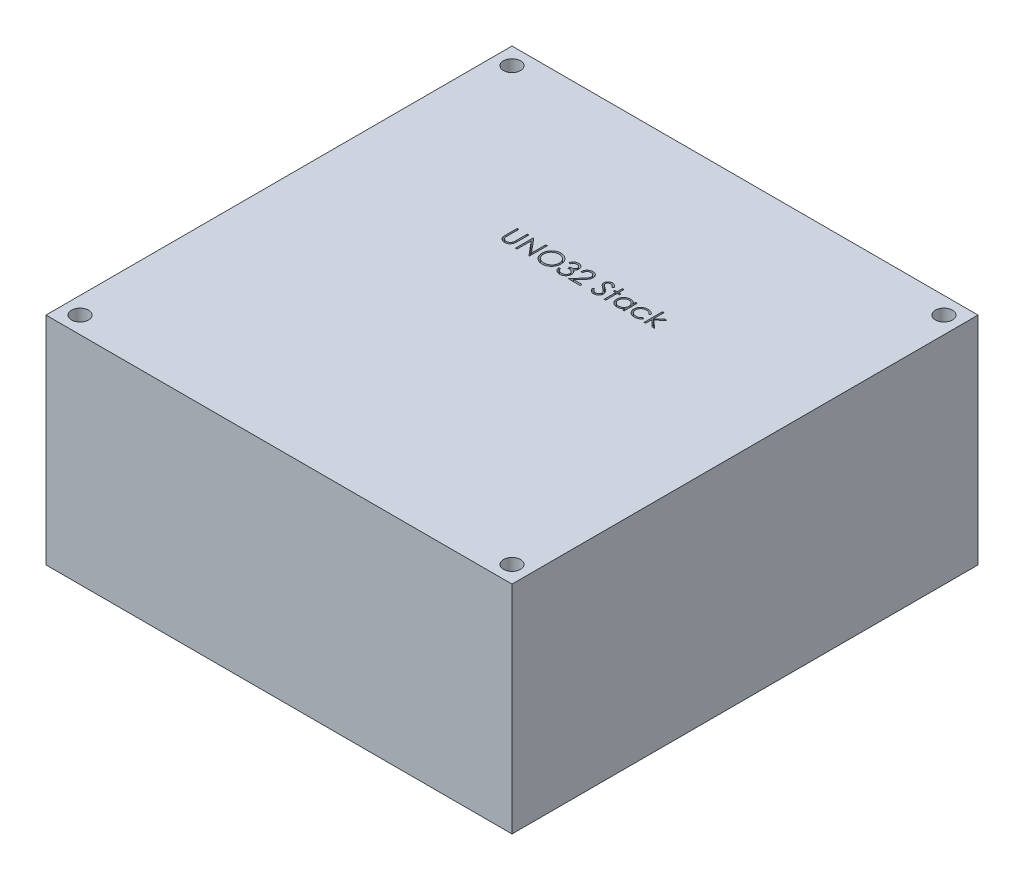
from build123d import *

# Parameters (mm, degrees)
SKETCH1_W           = 82.042
SKETCH1_H           = 82.042
BOSS_EXTRUDE1_DEPTH = 38.1
SKETCH2_R           = 1.5
CUT_EXTRUDE1_DEPTH  = 50.8
CUT_EXTRUDE2_DEPTH  = 1.27


with BuildPart() as part:
    # Sketch1 → Boss-Extrude1 (new body)
    with BuildSketch(Plane(origin=(0, 0, 0), x_dir=(1, 0, 0), z_dir=(0, 1, 0))):
        with Locations((41.021, 41.021)):
            Rectangle(SKETCH1_W, SKETCH1_H)
    extrude(amount=BOSS_EXTRUDE1_DEPTH)

    # Sketch2 → Cut-Extrude1 (cut)
    with BuildSketch(Plane(origin=(0, 38.1, 0), x_dir=(1, 0, 0), z_dir=(0, 1, 0))):
        with Locations(Location((3, 79.042, 0), (0, 0, 270))):
            Circle(SKETCH2_R)
        with Locations(Location((79.042, 79.042, 0), (0, 0, 90))):
            Circle(SKETCH2_R)
        with Locations(Location((79.042, 3, 0), (0, 0, 270))):
            Circle(SKETCH2_R)
        with Locations(Location((3, 3, 0), (0, 0, 90))):
            Circle(SKETCH2_R)
    extrude(amount=-CUT_EXTRUDE1_DEPTH, mode=Mode.SUBTRACT)

    # Sketch4 → Cut-Extrude2 (cut)
    # profile 1 of 10: a face of its own
    with BuildSketch(Plane(origin=(0, 38.1, 0), x_dir=(1, 0, 0), z_dir=(0, 1, 0))):
        with BuildLine():
            Line((28.272940627, 54.696713874), (28.557876525, 54.696713874))
            Line((28.557876525, 54.696713874), (28.557876525, 52.794385148))
            add(Edge.make_bspline(
                [(28.557876525, 52.794385148), (28.557834121, 52.767460481), (28.557753653, 52.716366285), (28.558291148, 52.643642183), (28.559796432, 52.578987881), (28.560745448, 52.522154159), (28.562856672, 52.473401809), (28.564578472, 52.432466706), (28.566792406, 52.39954268), (28.569453162, 52.380328554), (28.570596877, 52.372069443)],
                knots=[0, 0, 0, 0, 1.528628734, 2.90083645, 4.128790002, 5.200304208, 6.127813768, 6.898992206, 7.526736466, 8, 8, 8, 8], degree=3))
            add(Edge.make_bspline(
                [(28.570596877, 52.372069443), (28.575293572, 52.342272737), (28.58442232, 52.284358261), (28.607687248, 52.201891462), (28.640178838, 52.127567925), (28.678680741, 52.059068397), (28.72941961, 51.998299477), (28.790201388, 51.942318192), (28.863841221, 51.893358055), (28.945720485, 51.848589819), (29.033972093, 51.812607923), (29.124152314, 51.785399656), (29.214905588, 51.768818083), (29.275662537, 51.76689808), (29.305833255, 51.765944644)],
                knots=[0, 0, 0, 0, 1.035780045, 2.013197591, 2.933192213, 3.817615948, 4.702609284, 5.640816605, 6.646850145, 7.73207398, 8.84249596, 9.914020372, 10.964143139, 12, 12, 12, 12], degree=3))
            add(Edge.make_bspline(
                [(29.305833255, 51.765944644), (29.331735577, 51.766918779), (29.383390615, 51.768861424), (29.460140735, 51.780891437), (29.534889405, 51.802572664), (29.608005736, 51.830548731), (29.676541271, 51.867512617), (29.740534251, 51.910212593), (29.797651534, 51.960296744), (29.849774147, 52.015723485), (29.895162981, 52.078261733), (29.934506802, 52.146549758), (29.966733896, 52.221615237), (29.982648379, 52.274369606), (29.990824241, 52.301471487)],
                knots=[0, 0, 0, 0, 0.994687771, 1.983630487, 2.973142513, 3.978332533, 4.983357753, 5.956394766, 6.925816176, 7.893390482, 8.871859704, 9.88551698, 10.913711441, 12, 12, 12, 12], degree=3))
            add(Edge.make_bspline(
                [(29.990824241, 52.301471487), (29.993545783, 52.312673408), (29.999610476, 52.337635802), (30.005277438, 52.379837258), (30.011179786, 52.429629753), (30.015275146, 52.48737104), (30.019267682, 52.552867637), (30.021656255, 52.626460742), (30.022760278, 52.707883128), (30.023089281, 52.764703981), (30.02326114, 52.794385148)],
                knots=[0, 0, 0, 0, 0.558680831, 1.244966039, 2.062412453, 2.990489873, 4.051219941, 5.244515665, 6.560634259, 8, 8, 8, 8], degree=3))
            Line((30.02326114, 52.794385148), (30.02326114, 54.696713874))
            Line((30.02326114, 54.696713874), (30.308197037, 54.696713874))
            Line((30.308197037, 54.696713874), (30.308197037, 52.779120725))
            add(Edge.make_bspline(
                [(30.308197037, 52.779120725), (30.307966514, 52.744560053), (30.307516633, 52.6771128), (30.303615396, 52.578278353), (30.297395118, 52.484522434), (30.288606638, 52.39583244), (30.276961642, 52.312525739), (30.264011978, 52.233872128), (30.247520544, 52.160436199), (30.228258816, 52.091645363), (30.20623924, 52.02616279), (30.177717627, 51.964015689), (30.145582545, 51.90331477), (30.107469253, 51.844978128), (30.064641784, 51.788747469), (30.016153474, 51.734963808), (29.963607985, 51.682767673), (29.906131813, 51.633497963), (29.844672408, 51.588314378), (29.779412589, 51.548583543), (29.710853662, 51.514997833), (29.639173841, 51.487351815), (29.564342535, 51.466565), (29.486357859, 51.451075395), (29.405042305, 51.442274025), (29.349738653, 51.440965988), (29.321733696, 51.440303618)],
                knots=[0, 0, 0, 0, 1.316592851, 2.569410997, 3.76748051, 4.895814652, 5.963796859, 6.97159953, 7.931736103, 8.829262218, 9.692595152, 10.560224239, 11.431080259, 12.30701507, 13.211635791, 14.121146779, 15.063487852, 16.031507147, 17.00238618, 17.966455255, 18.938106653, 19.907068911, 20.888905087, 21.893141452, 22.933117798, 24, 24, 24, 24], degree=3))
            add(Edge.make_bspline(
                [(29.321733696, 51.440303618), (29.29119101, 51.441015512), (29.23126637, 51.442412246), (29.142966837, 51.450415741), (29.05831753, 51.465490998), (28.976424413, 51.48468609), (28.89840242, 51.511159909), (28.823206224, 51.54209178), (28.752123706, 51.580080437), (28.684001696, 51.622347301), (28.620660667, 51.669903937), (28.562515166, 51.721738237), (28.509469198, 51.777019866), (28.46241688, 51.83634734), (28.420578649, 51.899259246), (28.38453767, 51.965933556), (28.353592084, 52.036344457), (28.337620413, 52.085287718), (28.329546196, 52.11003018)],
                knots=[0, 0, 0, 0, 1.13879206, 2.234305948, 3.301075583, 4.341971843, 5.366689343, 6.369221514, 7.369726634, 8.367512178, 9.355451585, 10.318319045, 11.268648973, 12.207971039, 13.137398894, 14.081662264, 15.030215811, 16, 16, 16, 16], degree=3))
            add(Edge.make_bspline(
                [(28.329546196, 52.11003018), (28.324849774, 52.126932587), (28.31466313, 52.163594284), (28.303754467, 52.224269884), (28.294584086, 52.294133417), (28.285961187, 52.373189664), (28.28087306, 52.4614999), (28.276412241, 52.559025845), (28.272909201, 52.665885424), (28.272929859, 52.740320592), (28.272940627, 52.779120725)],
                knots=[0, 0, 0, 0, 0.625038921, 1.35572334, 2.194682327, 3.136881307, 4.189498639, 5.346923369, 6.617055217, 8, 8, 8, 8], degree=3))
            Line((28.272940627, 52.779120725), (28.272940627, 54.696713874))
        make_face()
    # profile 2 of 10: a face of its own
    with BuildSketch(Plane(origin=(0, 38.1, 0), x_dir=(1, 0, 0), z_dir=(0, 1, 0))):
        Polygon((31.122299601, 51.521713874), (31.122299601, 54.696713874), (31.182085259, 54.696713874), (33.279671396, 52.197800613), (33.279671396, 54.696713874), (33.564607294, 54.696713874), (33.564607294, 51.521713874), (33.499733496, 51.521713874), (31.407235499, 54.014902977), (31.407235499, 51.521713874), align=None)
    # profile 3 of 10: a face of its own
    with BuildSketch(Plane(origin=(0, 38.1, 0), x_dir=(1, 0, 0), z_dir=(0, 1, 0))):
        with BuildLine():
            add(Edge.make_bspline(
                [(35.864447037, 54.778124131), (35.923237248, 54.776635074), (36.038706071, 54.773710445), (36.208409729, 54.751322973), (36.370420994, 54.712592155), (36.526059619, 54.661009306), (36.673463963, 54.592198542), (36.813743529, 54.509027015), (36.946564551, 54.41062337), (37.070136804, 54.297748286), (37.183218466, 54.174936153), (37.282846234, 54.043874048), (37.366341743, 53.905354421), (37.43490885, 53.759793524), (37.488701161, 53.607520553), (37.525820579, 53.447723708), (37.549531615, 53.281438353), (37.552303642, 53.168021126), (37.553709858, 53.11048591)],
                knots=[0, 0, 0, 0, 1.065120563, 2.091984664, 3.0946048, 4.079830382, 5.057816894, 6.036188127, 7.030412546, 8.04752943, 9.064399622, 10.05169764, 11.02544977, 11.989514704, 12.962713494, 13.945757189, 14.957906945, 16, 16, 16, 16], degree=3))
            add(Edge.make_bspline(
                [(37.553709858, 53.11048591), (37.552303848, 53.053374512), (37.549532439, 52.94080133), (37.525793619, 52.775571206), (37.488563569, 52.616738931), (37.435408385, 52.464569661), (37.367168129, 52.318902871), (37.283116653, 52.180121848), (37.184109983, 52.048181096), (37.071436625, 51.924526036), (36.948608537, 51.811135473), (36.816863938, 51.712330493), (36.679165712, 51.627309323), (36.533741905, 51.559469847), (36.382521158, 51.505248176), (36.22415005, 51.468279719), (36.059370676, 51.444433615), (35.94700198, 51.44169539), (35.889887743, 51.440303618)],
                knots=[0, 0, 0, 0, 1.043624062, 2.057103931, 3.04512605, 4.022047818, 4.998200453, 5.980619268, 6.982898556, 8.009068085, 9.034988726, 10.034168286, 11.015286542, 11.987931943, 12.962482838, 13.94673481, 14.956375938, 16, 16, 16, 16], degree=3))
            add(Edge.make_bspline(
                [(35.889887743, 51.440303618), (35.832352825, 51.441709133), (35.718936186, 51.444479778), (35.552441875, 51.468230052), (35.392532779, 51.505369663), (35.239666189, 51.558446081), (35.09375686, 51.627041711), (34.954519428, 51.710684255), (34.822512773, 51.809932162), (34.698831331, 51.922568983), (34.585665987, 52.045188891), (34.487005696, 52.176574251), (34.403344344, 52.314147415), (34.334979035, 52.458290169), (34.280854847, 52.608305692), (34.243929762, 52.765194668), (34.220039291, 52.928062648), (34.217286252, 53.038954421), (34.215889345, 53.095221487)],
                knots=[0, 0, 0, 0, 1.053102029, 2.075944431, 3.073151272, 4.055350789, 5.033113405, 6.020478099, 7.024410459, 8.052272461, 9.079885166, 10.07527673, 11.055994387, 12.023226415, 12.992069828, 13.970394897, 14.97016774, 16, 16, 16, 16], degree=3))
            add(Edge.make_bspline(
                [(34.215889345, 53.095221487), (34.216374336, 53.132988265), (34.217338199, 53.208045377), (34.228942091, 53.319502936), (34.245780206, 53.429168032), (34.269911941, 53.536728821), (34.301472953, 53.641922), (34.338713007, 53.745473049), (34.384197009, 53.84633257), (34.435614454, 53.944978361), (34.493001952, 54.039872675), (34.556389239, 54.129570583), (34.623549894, 54.214824773), (34.697176687, 54.293425984), (34.774843034, 54.3676608), (34.857808848, 54.436388408), (34.945567884, 54.500228542), (35.038497757, 54.557759852), (35.134308621, 54.609792781), (35.233075412, 54.654444031), (35.333456731, 54.692767244), (35.435922733, 54.723828564), (35.540201319, 54.748350483), (35.64652008, 54.765048582), (35.754794317, 54.77668207), (35.827738871, 54.777641376), (35.864447037, 54.778124131)],
                knots=[0, 0, 0, 0, 1.037015668, 2.060948919, 3.074880161, 4.083647147, 5.086022904, 6.090072063, 7.104153813, 8.122640571, 9.144368836, 10.147691507, 11.138137339, 12.123020368, 13.103399296, 14.087645067, 15.080126199, 16.082011238, 17.087798457, 18.072939717, 19.057185487, 20.037253025, 21.01195951, 21.997135196, 22.992090687, 24, 24, 24, 24], degree=3))
        make_face()
        with BuildLine():
            add(Edge.make_bspline(
                [(35.878439425, 54.452483105), (35.848309008, 54.452115812), (35.788336221, 54.451384737), (35.699178106, 54.441754766), (35.611192566, 54.428029795), (35.524361431, 54.408452273), (35.439048011, 54.381778596), (35.354457084, 54.351080058), (35.271360028, 54.31368664), (35.190031171, 54.271438544), (35.111186781, 54.224676309), (35.036789545, 54.172994777), (34.966646861, 54.117605946), (34.900930469, 54.058380551), (34.839833334, 53.995016983), (34.782152926, 53.928475845), (34.730201234, 53.856855201), (34.682589318, 53.782097189), (34.639982778, 53.704299183), (34.602095634, 53.624280237), (34.571103998, 53.541387621), (34.545828842, 53.456520635), (34.524874014, 53.369813689), (34.511598954, 53.280609027), (34.501863171, 53.189354889), (34.501173882, 53.127685636), (34.500825243, 53.096493522)],
                knots=[0, 0, 0, 0, 1.008559885, 2.007477868, 2.99961109, 3.989939068, 4.984837346, 5.991145699, 7.001802488, 8.033829008, 9.059044045, 10.069351652, 11.065060232, 12.050310815, 13.029377138, 14.011219647, 14.996725999, 15.989392538, 16.977580475, 17.965360261, 18.951710183, 19.937753436, 20.929683414, 21.935841486, 22.955955122, 24, 24, 24, 24], degree=3))
            add(Edge.make_bspline(
                [(34.500825243, 53.096493522), (34.501981724, 53.050626364), (34.504256882, 52.960391476), (34.524175535, 52.828158946), (34.554856898, 52.701078857), (34.600084651, 52.579846554), (34.656645566, 52.463419954), (34.726519959, 52.352831888), (34.809304987, 52.248052466), (34.903342615, 52.149813187), (35.006142499, 52.060145921), (35.115301475, 51.981439115), (35.229650105, 51.914845531), (35.349486581, 51.860593787), (35.474171135, 51.817604525), (35.604507199, 51.788141767), (35.739626544, 51.768751175), (35.831729353, 51.766889032), (35.878439425, 51.765944644)],
                knots=[0, 0, 0, 0, 1.032063989, 2.030389145, 3.003944642, 3.970395727, 4.937377036, 5.913328081, 6.909231446, 7.93887556, 8.970685674, 9.976071282, 10.964166581, 11.944589148, 12.933237628, 13.927779006, 14.949070134, 16, 16, 16, 16], degree=3))
            add(Edge.make_bspline(
                [(35.878439425, 51.765944644), (35.909835187, 51.766375994), (35.972102413, 51.767231491), (36.064717637, 51.775848148), (36.155664343, 51.78966563), (36.244814969, 51.809559867), (36.332068333, 51.834458405), (36.417788619, 51.864038272), (36.501062782, 51.900941935), (36.58294135, 51.941716149), (36.661315083, 51.988198292), (36.736132173, 52.038125756), (36.805506812, 52.093433005), (36.871174041, 52.151778449), (36.932522016, 52.214338511), (36.98913588, 52.281031855), (37.040825, 52.352279451), (37.088418837, 52.426924069), (37.130876082, 52.504934956), (37.167868551, 52.585244021), (37.19925217, 52.667653513), (37.224587314, 52.752282295), (37.244440554, 52.838969637), (37.258120196, 52.927831608), (37.267689136, 53.01869044), (37.268410385, 53.080143795), (37.26877396, 53.111121927)],
                knots=[0, 0, 0, 0, 1.047197238, 2.076906641, 3.100256066, 4.114471768, 5.12198147, 6.126382909, 7.136867548, 8.15857795, 9.17633901, 10.174870724, 11.156907918, 12.133735059, 13.104061851, 14.077631395, 15.04955518, 16.038496417, 17.029181396, 18.010275684, 18.986308667, 19.968651475, 20.955262928, 21.950658345, 22.966943676, 24, 24, 24, 24], degree=3))
            add(Edge.make_bspline(
                [(37.26877396, 53.111121927), (37.268410094, 53.141888135), (37.267688297, 53.202918574), (37.258124766, 53.293143745), (37.244426102, 53.381366302), (37.224684216, 53.467239894), (37.19923872, 53.550786413), (37.16786307, 53.631927392), (37.130864977, 53.710965112), (37.088403231, 53.787704224), (37.040673162, 53.861341308), (36.98851767, 53.931737782), (36.931036247, 53.997571626), (36.86987121, 54.060468098), (36.803494764, 54.119085755), (36.732207583, 54.173444042), (36.656875104, 54.224854798), (36.57711254, 54.271232986), (36.494794811, 54.31406304), (36.410327149, 54.350757878), (36.324666466, 54.381938301), (36.238030593, 54.408532976), (36.149690319, 54.427953118), (36.06024256, 54.441767135), (35.969811069, 54.451381385), (35.908993291, 54.4521147), (35.878439425, 54.452483105)],
                knots=[0, 0, 0, 0, 1.02996197, 2.043119294, 3.035359645, 4.018872909, 4.991431989, 5.957985074, 6.929999688, 7.912076566, 8.892894881, 9.867085534, 10.843653904, 11.817741046, 12.803660682, 13.806313499, 14.818574707, 15.856120519, 16.894564902, 17.924820532, 18.937903209, 19.946497019, 20.957711757, 21.963978472, 22.977135795, 24, 24, 24, 24], degree=3))
        make_face(mode=Mode.SUBTRACT)
    # profile 4 of 10: a face of its own
    with BuildSketch(Plane(origin=(0, 38.1, 0), x_dir=(1, 0, 0), z_dir=(0, 1, 0))):
        with BuildLine():
            Line((38.327107294, 53.964021567), (38.042171396, 53.964021567))
            add(Edge.make_bspline(
                [(38.042171396, 53.964021567), (38.049890774, 53.995982463), (38.064981527, 54.058463401), (38.096457183, 54.147732844), (38.130746508, 54.232209182), (38.17192091, 54.31031062), (38.216832422, 54.383606767), (38.268288034, 54.450435188), (38.323913782, 54.51249552), (38.385440701, 54.5675711), (38.449964558, 54.617443755), (38.518394534, 54.659966128), (38.589353874, 54.696545895), (38.663334216, 54.726681391), (38.740555814, 54.749383116), (38.820320544, 54.765853933), (38.902837434, 54.776550158), (38.958851319, 54.777594064), (38.987293592, 54.778124131)],
                knots=[0, 0, 0, 0, 1.162005537, 2.271625781, 3.343758855, 4.383309926, 5.390229558, 6.379919256, 7.361854164, 8.333198761, 9.295911338, 10.242430842, 11.177959212, 12.116337295, 13.062827104, 14.020064771, 14.994644689, 16, 16, 16, 16], degree=3))
            add(Edge.make_bspline(
                [(38.987293592, 54.778124131), (39.028734365, 54.776872972), (39.110711968, 54.774397946), (39.231147018, 54.751796992), (39.347285632, 54.716032765), (39.457856593, 54.666617313), (39.560561885, 54.605668822), (39.651943997, 54.533129382), (39.730764289, 54.450398587), (39.796889903, 54.359019761), (39.848665081, 54.261360834), (39.886843434, 54.160849263), (39.910085959, 54.057723475), (39.913098178, 53.988093657), (39.914607294, 53.953209267)],
                knots=[0, 0, 0, 0, 1.083050992, 2.142477498, 3.193116406, 4.255571735, 5.30263384, 6.308962982, 7.297363603, 8.282367274, 9.249857812, 10.179914175, 11.08814088, 12, 12, 12, 12], degree=3))
            add(Edge.make_bspline(
                [(39.914607294, 53.953209267), (39.91355175, 53.919638817), (39.911486216, 53.853946657), (39.893947783, 53.758042156), (39.864432745, 53.66765299), (39.823548031, 53.582398651), (39.770623911, 53.502819689), (39.706513679, 53.428737059), (39.630764836, 53.35982218), (39.573361799, 53.320343801), (39.543809017, 53.300019163)],
                knots=[0, 0, 0, 0, 1.024540389, 2.004866551, 2.965041327, 3.920577974, 4.882998113, 5.874504559, 6.905732034, 8, 8, 8, 8], degree=3))
            add(Edge.make_bspline(
                [(39.543809017, 53.300019163), (39.577583537, 53.283710393), (39.64450063, 53.251398003), (39.735714325, 53.188028851), (39.818516397, 53.114862022), (39.864693342, 53.057764044), (39.887894553, 53.029075653)],
                knots=[0, 0, 0, 0, 1.015518401, 2.012035669, 3.001164323, 4, 4, 4, 4], degree=3))
            add(Edge.make_bspline(
                [(39.887894553, 53.029075653), (39.903172057, 53.008158979), (39.933476884, 52.966668154), (39.970883404, 52.899960111), (40.004818815, 52.832512688), (40.031262228, 52.762518084), (40.05173995, 52.690787565), (40.066377636, 52.617197963), (40.075470964, 52.541689185), (40.076773215, 52.490605721), (40.077427807, 52.464928017)],
                knots=[0, 0, 0, 0, 1.025084078, 2.033381695, 3.024893161, 4.013698104, 4.991890475, 5.976764909, 6.982997093, 8, 8, 8, 8], degree=3))
            add(Edge.make_bspline(
                [(40.077427807, 52.464928017), (40.075799926, 52.420469198), (40.072551827, 52.331760785), (40.04351956, 52.200701574), (39.998513263, 52.072589868), (39.934598757, 51.950057692), (39.856704659, 51.835412632), (39.764033372, 51.732836266), (39.657637845, 51.644663247), (39.538978435, 51.570993968), (39.410420754, 51.512104139), (39.272920038, 51.471230602), (39.128457489, 51.444609588), (39.029390869, 51.441754928), (38.979025363, 51.440303618)],
                knots=[0, 0, 0, 0, 0.955779014, 1.907060117, 2.875433937, 3.871313158, 4.872415639, 5.851225146, 6.836215519, 7.83643374, 8.849228613, 9.86973379, 10.916971861, 12, 12, 12, 12], degree=3))
            add(Edge.make_bspline(
                [(38.979025363, 51.440303618), (38.945080712, 51.441091211), (38.878288958, 51.442640933), (38.780096641, 51.453235092), (38.6863691, 51.472584454), (38.596979608, 51.498622453), (38.511848753, 51.531634962), (38.431236315, 51.572745495), (38.35464634, 51.621106643), (38.282801577, 51.677289255), (38.215710591, 51.740137327), (38.155156334, 51.810766572), (38.100129236, 51.88787136), (38.052102699, 51.972347275), (38.008889178, 52.063102616), (37.973346453, 52.161299468), (37.942063116, 52.266059974), (37.927518473, 52.339064781), (37.920056012, 52.376521567)],
                knots=[0, 0, 0, 0, 1.048658725, 2.063410685, 3.046034179, 4.001477787, 4.936774919, 5.862367409, 6.792675028, 7.730719943, 8.675894397, 9.627829632, 10.600096036, 11.597688215, 12.626045268, 13.701542398, 14.82072376, 16, 16, 16, 16], degree=3))
            Line((37.920056012, 52.376521567), (38.204991909, 52.376521567))
            add(Edge.make_bspline(
                [(38.204991909, 52.376521567), (38.212415324, 52.352074962), (38.226854509, 52.304524192), (38.251432908, 52.236089057), (38.279434841, 52.173352823), (38.309474476, 52.115855277), (38.341023495, 52.063030169), (38.376324891, 52.016274331), (38.412764044, 51.973534112), (38.440231744, 51.949454356), (38.453674802, 51.937669403)],
                knots=[0, 0, 0, 0, 1.198163088, 2.33053128, 3.407730985, 4.417276592, 5.372219308, 6.28897303, 7.162600585, 8, 8, 8, 8], degree=3))
            add(Edge.make_bspline(
                [(38.453674802, 51.937669403), (38.471451696, 51.923963986), (38.506950612, 51.896595457), (38.564797507, 51.86166898), (38.62563494, 51.831405764), (38.690781108, 51.808288411), (38.758830222, 51.788714391), (38.830882189, 51.775905063), (38.906301336, 51.767116507), (38.957797807, 51.766340962), (38.984113504, 51.765944644)],
                knots=[0, 0, 0, 0, 0.946170439, 1.889420265, 2.845303464, 3.807233317, 4.801018734, 5.828864929, 6.890507805, 8, 8, 8, 8], degree=3))
            add(Edge.make_bspline(
                [(38.984113504, 51.765944644), (39.01382561, 51.766503358), (39.071925068, 51.767595875), (39.156701976, 51.777643123), (39.237353732, 51.792275712), (39.312984886, 51.814875347), (39.384586132, 51.842797976), (39.451153771, 51.877857601), (39.513561668, 51.918991742), (39.571010486, 51.965745121), (39.622668196, 52.016927478), (39.668151897, 52.070460763), (39.706818554, 52.126119266), (39.738009372, 52.18421099), (39.7626388, 52.244495376), (39.779405703, 52.3071416), (39.791063863, 52.371636977), (39.79201329, 52.415478256), (39.792491909, 52.437579259)],
                knots=[0, 0, 0, 0, 1.217147791, 2.380027433, 3.494444702, 4.572153297, 5.609568379, 6.639424714, 7.649109417, 8.668170816, 9.669597737, 10.625200337, 11.543417969, 12.441394052, 13.322311151, 14.205496177, 15.095365482, 16, 16, 16, 16], degree=3))
            add(Edge.make_bspline(
                [(39.792491909, 52.437579259), (39.791103707, 52.467162402), (39.78833421, 52.526181487), (39.767189999, 52.613011001), (39.732411172, 52.69667081), (39.683722537, 52.775733563), (39.624453697, 52.849008845), (39.555179818, 52.914387975), (39.475325639, 52.968335844), (39.401829044, 53.005609125), (39.336727794, 53.031042757), (39.281015267, 53.047983618), (39.218643205, 53.062328863), (39.150365875, 53.075674995), (39.075668814, 53.087033646), (38.994633345, 53.096505865), (38.907243047, 53.104085081), (38.846744633, 53.107469717), (38.815568832, 53.109213874)],
                knots=[0, 0, 0, 0, 1.07054697, 2.135767047, 3.216561865, 4.33974944, 5.486079747, 6.621378074, 7.775625952, 8.963672916, 9.598146892, 10.304877434, 11.070270905, 11.915000392, 12.823868403, 13.805723172, 14.86925407, 16, 16, 16, 16], degree=3))
            Line((38.815568832, 53.109213874), (38.815568832, 53.4348549))
            add(Edge.make_bspline(
                [(38.815568832, 53.4348549), (38.854849175, 53.435521472), (38.931789718, 53.436827123), (39.044179552, 53.452618675), (39.151651771, 53.474463245), (39.251824601, 53.507923383), (39.343127363, 53.546785653), (39.422338716, 53.592008728), (39.488348914, 53.642277822), (39.540837171, 53.698368832), (39.5803244, 53.758526054), (39.609195852, 53.821224736), (39.626250434, 53.88701442), (39.62852706, 53.931913155), (39.629671396, 53.954481302)],
                knots=[0, 0, 0, 0, 1.321986639, 2.589447074, 3.816329219, 5.01088745, 6.139805852, 7.153945165, 8.075214402, 8.924034688, 9.728124013, 10.488707548, 11.240355623, 12, 12, 12, 12], degree=3))
            add(Edge.make_bspline(
                [(39.629671396, 53.954481302), (39.629295466, 53.971061828), (39.628547572, 54.004047998), (39.619115755, 54.052240025), (39.604942518, 54.09895874), (39.585457335, 54.144005468), (39.559376798, 54.187067788), (39.528165653, 54.228512831), (39.491001733, 54.268103973), (39.448415506, 54.305006834), (39.402684798, 54.340176071), (39.352565359, 54.370033442), (39.299568372, 54.395565034), (39.243635164, 54.416619368), (39.184584219, 54.432457436), (39.122692984, 54.443829235), (39.057843443, 54.450939108), (39.013600515, 54.451962742), (38.991109698, 54.452483105)],
                knots=[0, 0, 0, 0, 0.884392785, 1.759457502, 2.611959086, 3.489218968, 4.37281399, 5.2945488, 6.255912374, 7.266815255, 8.301784654, 9.332968512, 10.37626691, 11.440494194, 12.520033166, 13.637162961, 14.798855837, 16, 16, 16, 16], degree=3))
            add(Edge.make_bspline(
                [(38.991109698, 54.452483105), (38.954958542, 54.451220941), (38.884346926, 54.448755641), (38.782551966, 54.427162907), (38.687919427, 54.39271136), (38.615585065, 54.351587835), (38.562170159, 54.310992799), (38.524000365, 54.275539491), (38.486516759, 54.236139716), (38.452185323, 54.190366761), (38.417465359, 54.141320458), (38.385856364, 54.086507547), (38.355140786, 54.027357847), (38.336632759, 53.985542521), (38.327107294, 53.964021567)],
                knots=[0, 0, 0, 0, 1.472543308, 2.876219568, 4.221790263, 5.565193594, 6.249813518, 6.953379497, 7.687249741, 8.463570142, 9.283606569, 10.136032583, 11.040678096, 12, 12, 12, 12], degree=3))
        make_face()
    # profile 5 of 10: a face of its own
    with BuildSketch(Plane(origin=(0, 38.1, 0), x_dir=(1, 0, 0), z_dir=(0, 1, 0))):
        with BuildLine():
            Line((40.769414986, 53.719790797), (40.484479089, 53.719790797))
            add(Edge.make_bspline(
                [(40.484479089, 53.719790797), (40.486336149, 53.757592246), (40.489983366, 53.831833284), (40.507063314, 53.940077113), (40.531502538, 54.043541109), (40.566056929, 54.141394531), (40.608970481, 54.234502592), (40.66043272, 54.322495463), (40.721387141, 54.40503747), (40.790517536, 54.481363421), (40.865600515, 54.551383575), (40.946613761, 54.611849402), (41.031744607, 54.662937575), (41.120734776, 54.705646987), (41.214588287, 54.737705276), (41.312453451, 54.761492049), (41.414760239, 54.775803449), (41.484465116, 54.777341768), (41.519915787, 54.778124131)],
                knots=[0, 0, 0, 0, 1.10065271, 2.161652631, 3.183658789, 4.190468796, 5.17591951, 6.163126047, 7.15150782, 8.156236427, 9.156009102, 10.134482811, 11.092018607, 12.041330605, 13.001268258, 13.972401359, 14.968799086, 16, 16, 16, 16], degree=3))
            add(Edge.make_bspline(
                [(41.519915787, 54.778124131), (41.554730183, 54.777309102), (41.623139227, 54.775707601), (41.722981198, 54.761954381), (41.818029172, 54.740413738), (41.90809736, 54.710191896), (41.992467147, 54.669566022), (42.071772338, 54.620763969), (42.146957073, 54.564321694), (42.214636084, 54.49787002), (42.276782699, 54.426929286), (42.330396887, 54.35119383), (42.376310257, 54.27297155), (42.414580509, 54.191665967), (42.442752864, 54.106511534), (42.464141667, 54.018748), (42.476231535, 53.927466921), (42.478087026, 53.865684546), (42.479030371, 53.834273971)],
                knots=[0, 0, 0, 0, 1.111607364, 2.184268762, 3.212621178, 4.221274766, 5.211760367, 6.196651075, 7.1921475, 8.207485113, 9.220403448, 10.201281604, 11.166441695, 12.114753415, 13.065576456, 14.026450734, 14.996634279, 16, 16, 16, 16], degree=3))
            add(Edge.make_bspline(
                [(42.479030371, 53.834273971), (42.477494339, 53.790052721), (42.474449232, 53.702386241), (42.44840119, 53.573558473), (42.407718998, 53.448741585), (42.358735682, 53.348287033), (42.309321393, 53.267339506), (42.264792011, 53.200692895), (42.212663218, 53.128932935), (42.152176295, 53.052299922), (42.084582475, 52.970193601), (42.009269513, 52.882663572), (41.925700354, 52.790614181), (41.867045857, 52.727744099), (41.836652566, 52.695166398)],
                knots=[0, 0, 0, 0, 1.184426356, 2.348067706, 3.509069118, 4.696110526, 5.333549288, 6.050745305, 6.844228056, 7.710549037, 8.667450064, 9.695053472, 10.805634456, 12, 12, 12, 12], degree=3))
            Line((41.836652566, 52.695166398), (41.042266549, 51.8473549))
            Line((41.042266549, 51.8473549), (42.519735499, 51.8473549))
            Line((42.519735499, 51.8473549), (42.519735499, 51.521713874))
            Line((42.519735499, 51.521713874), (40.362363704, 51.521713874))
            Line((40.362363704, 51.521713874), (41.593693832, 52.835726294))
            add(Edge.make_bspline(
                [(41.593693832, 52.835726294), (41.623672987, 52.867021187), (41.681256807, 52.92713227), (41.76270243, 53.014891955), (41.835853513, 53.09630761), (41.901183576, 53.171225408), (41.957275399, 53.240741187), (42.007052352, 53.302603525), (42.046935424, 53.359530777), (42.090220104, 53.425516905), (42.132142787, 53.506082364), (42.168167567, 53.604537925), (42.190133894, 53.705890504), (42.192768995, 53.774381638), (42.194094473, 53.808833265)],
                knots=[0, 0, 0, 0, 1.329631726, 2.553950428, 3.673215718, 4.687767853, 5.603093632, 6.413772471, 7.123043292, 7.734684054, 8.834405432, 9.900288307, 10.943827018, 12, 12, 12, 12], degree=3))
            add(Edge.make_bspline(
                [(42.194094473, 53.808833265), (42.193517764, 53.830497105), (42.192381181, 53.873192374), (42.18235027, 53.935790455), (42.167191454, 53.996174251), (42.145469684, 54.054529498), (42.116797855, 54.110269482), (42.081897004, 54.163462054), (42.041628875, 54.214887044), (41.995045938, 54.263104678), (41.94387263, 54.307265486), (41.889812132, 54.346385192), (41.832616681, 54.379077814), (41.772527427, 54.405877987), (41.709711894, 54.426901368), (41.64404859, 54.441468794), (41.575718946, 54.450615047), (41.529061418, 54.451852546), (41.505287382, 54.452483105)],
                knots=[0, 0, 0, 0, 0.991446411, 1.95395049, 2.89581595, 3.838931463, 4.798493298, 5.75982156, 6.748411868, 7.785213223, 8.824556874, 9.840280684, 10.836137867, 11.835679398, 12.848801643, 13.863922112, 14.911575587, 16, 16, 16, 16], degree=3))
            add(Edge.make_bspline(
                [(41.505287382, 54.452483105), (41.480458127, 54.451834469), (41.431697569, 54.450560654), (41.360106731, 54.441650094), (41.291811776, 54.426277796), (41.226640907, 54.405253242), (41.164483854, 54.37853013), (41.1056429, 54.345245475), (41.050250136, 54.305527592), (40.998201433, 54.260496516), (40.950246252, 54.210360907), (40.9081123, 54.154471869), (40.871296802, 54.093849856), (40.839175568, 54.028658442), (40.81309005, 53.958306085), (40.793157263, 53.883042524), (40.777384909, 53.803194557), (40.772115751, 53.748053801), (40.769414986, 53.719790797)],
                knots=[0, 0, 0, 0, 1.031018746, 2.02475058, 2.990194455, 3.934040569, 4.864654155, 5.795059489, 6.735614925, 7.690564532, 8.649604399, 9.611025574, 10.590972636, 11.591080095, 12.624614302, 13.701020113, 14.821632451, 16, 16, 16, 16], degree=3))
        make_face()
    # profile 6 of 10: a face of its own
    with BuildSketch(Plane(origin=(0, 38.1, 0), x_dir=(1, 0, 0), z_dir=(0, 1, 0))):
        with BuildLine():
            Line((43.985120114, 52.13419885), (44.253519553, 52.29511131))
            add(Edge.make_bspline(
                [(44.253519553, 52.29511131), (44.278482526, 52.253324332), (44.326310617, 52.173262096), (44.406095065, 52.065078016), (44.488765634, 51.97312806), (44.57493453, 51.897947137), (44.664075783, 51.838757076), (44.756771317, 51.796845051), (44.85270876, 51.770704845), (44.917999298, 51.767529766), (44.950594874, 51.765944644)],
                knots=[0, 0, 0, 0, 1.272034388, 2.437168799, 3.508375237, 4.49857839, 5.41946034, 6.295179144, 7.148887113, 8, 8, 8, 8], degree=3))
            add(Edge.make_bspline(
                [(44.950594874, 51.765944644), (44.97843224, 51.766719954), (45.033619884, 51.768257008), (45.114865633, 51.783026021), (45.193770554, 51.805715595), (45.26870839, 51.838210297), (45.338645126, 51.877524495), (45.399974056, 51.925009956), (45.452993031, 51.978174157), (45.496362727, 52.037485565), (45.529636759, 52.101273264), (45.555210993, 52.166747163), (45.56940331, 52.234935793), (45.571541222, 52.280846712), (45.572620114, 52.304015557)],
                knots=[0, 0, 0, 0, 1.095163259, 2.171163733, 3.241058638, 4.321873601, 5.38011039, 6.391990106, 7.366004449, 8.327778327, 9.272591725, 10.192022065, 11.087607919, 12, 12, 12, 12], degree=3))
            add(Edge.make_bspline(
                [(45.572620114, 52.304015557), (45.571282704, 52.330450471), (45.568563944, 52.384188787), (45.545584673, 52.463472758), (45.509435713, 52.541933875), (45.476086743, 52.590467166), (45.458772959, 52.615664195)],
                knots=[0, 0, 0, 0, 0.938893495, 1.908633276, 2.914225137, 4, 4, 4, 4], degree=3))
            add(Edge.make_bspline(
                [(45.458772959, 52.615664195), (45.444557473, 52.633849528), (45.414713839, 52.672027359), (45.363408095, 52.728855537), (45.303204549, 52.787473674), (45.236163467, 52.850120105), (45.159842736, 52.913881177), (45.076632777, 52.981797401), (44.984409133, 53.051285974), (44.919730304, 53.09788823), (44.886357093, 53.121934227)],
                knots=[0, 0, 0, 0, 0.722233717, 1.516239348, 2.393582979, 3.351407094, 4.387010283, 5.505090956, 6.712668013, 8, 8, 8, 8], degree=3))
            add(Edge.make_bspline(
                [(44.886357093, 53.121934227), (44.852952468, 53.145727303), (44.789085369, 53.191217852), (44.699769369, 53.25873131), (44.619900463, 53.32045682), (44.549833641, 53.37697546), (44.489599721, 53.428294894), (44.438724056, 53.47392231), (44.39850265, 53.515091683), (44.376136516, 53.541799186), (44.366094674, 53.553790196)],
                knots=[0, 0, 0, 0, 1.452282411, 2.77665338, 3.964542531, 5.026858415, 5.96415736, 6.766646006, 7.446254459, 8, 8, 8, 8], degree=3))
            add(Edge.make_bspline(
                [(44.366094674, 53.553790196), (44.352058865, 53.57247828), (44.324455563, 53.609230904), (44.288019258, 53.666675596), (44.25705016, 53.725479559), (44.232772902, 53.785800807), (44.212329332, 53.846792493), (44.198578923, 53.909250408), (44.18996887, 53.972894298), (44.18908714, 54.015723688), (44.188645755, 54.037163594)],
                knots=[0, 0, 0, 0, 1.068054152, 2.10047183, 3.106115577, 4.101338837, 5.06977816, 6.043150881, 7.020423561, 8, 8, 8, 8], degree=3))
            add(Edge.make_bspline(
                [(44.188645755, 54.037163594), (44.189829766, 54.070754889), (44.192172481, 54.13721949), (44.21198495, 54.234311743), (44.243256789, 54.327009422), (44.287067152, 54.414394796), (44.343543465, 54.494192507), (44.408899456, 54.567320456), (44.486742733, 54.628796241), (44.572152613, 54.682510037), (44.665639464, 54.724552412), (44.763602641, 54.756267016), (44.866197842, 54.774236842), (44.935687828, 54.776815636), (44.970947438, 54.778124131)],
                knots=[0, 0, 0, 0, 1.005424448, 1.989358655, 2.955360095, 3.929531133, 4.905563448, 5.876582895, 6.856512386, 7.866279853, 8.892233794, 9.918561126, 10.94386622, 12, 12, 12, 12], degree=3))
            add(Edge.make_bspline(
                [(44.970947438, 54.778124131), (45.008361729, 54.776833673), (45.082766812, 54.774267365), (45.192212887, 54.75195389), (45.297587251, 54.715032567), (45.382353641, 54.673132855), (45.448695503, 54.631285071), (45.499289339, 54.593167088), (45.550558741, 54.549283953), (45.602917262, 54.49951878), (45.655477717, 54.443414942), (45.709020421, 54.381356674), (45.763670579, 54.313723227), (45.79882768, 54.265441001), (45.816850884, 54.240689235)],
                knots=[0, 0, 0, 0, 1.286793592, 2.559021753, 3.825965368, 5.121522368, 5.803751409, 6.523245864, 7.299691795, 8.125521123, 9.008227632, 9.944561021, 10.946284179, 12, 12, 12, 12], degree=3))
            Line((45.816850884, 54.240689235), (45.559263744, 54.045431823))
            add(Edge.make_bspline(
                [(45.559263744, 54.045431823), (45.543709934, 54.065469421), (45.513756932, 54.104057149), (45.468282326, 54.158096843), (45.425421053, 54.207460363), (45.38319319, 54.250336587), (45.343828967, 54.289073522), (45.305622793, 54.322238444), (45.269124489, 54.350156306), (45.223117006, 54.379950106), (45.165315933, 54.409483506), (45.092758532, 54.434474455), (45.01693384, 54.449492262), (44.965290531, 54.451477895), (44.939146557, 54.452483105)],
                knots=[0, 0, 0, 0, 1.181633172, 2.275549214, 3.290209073, 4.226197932, 5.078386478, 5.862611352, 6.581680152, 7.217281963, 8.414376989, 9.595101626, 10.782541182, 12, 12, 12, 12], degree=3))
            add(Edge.make_bspline(
                [(44.939146557, 54.452483105), (44.906347426, 54.45138392), (44.843097391, 54.449264246), (44.753299106, 54.426113973), (44.672478188, 54.389663286), (44.603034075, 54.338577555), (44.545215532, 54.278052084), (44.503391294, 54.208402694), (44.478217931, 54.131492943), (44.475146091, 54.077843012), (44.473581653, 54.050519964)],
                knots=[0, 0, 0, 0, 1.14458467, 2.207223713, 3.21896685, 4.227309161, 5.202851033, 6.127160689, 7.046193047, 8, 8, 8, 8], degree=3))
            add(Edge.make_bspline(
                [(44.473581653, 54.050519964), (44.473938275, 54.033509694), (44.474652102, 53.99946134), (44.484607811, 53.949158978), (44.497397917, 53.898983692), (44.517665876, 53.849161063), (44.545646973, 53.798819752), (44.582390954, 53.74709289), (44.628667315, 53.693524554), (44.664115748, 53.658683579), (44.682831452, 53.640288594)],
                knots=[0, 0, 0, 0, 0.858281714, 1.717966888, 2.583508476, 3.4729293, 4.427298488, 5.488583878, 6.674047936, 8, 8, 8, 8], degree=3))
            add(Edge.make_bspline(
                [(44.682831452, 53.640288594), (44.689781412, 53.634086435), (44.706292924, 53.619351524), (44.736478942, 53.595228527), (44.776341338, 53.565471726), (44.824839192, 53.528653232), (44.882866727, 53.48594362), (44.950430324, 53.437888986), (45.026776858, 53.38292932), (45.080953167, 53.344504979), (45.109599281, 53.324187833)],
                knots=[0, 0, 0, 0, 0.420754252, 0.999615792, 1.744751191, 2.668019286, 3.750313428, 4.999500688, 6.413464383, 8, 8, 8, 8], degree=3))
            add(Edge.make_bspline(
                [(45.109599281, 53.324187833), (45.144057931, 53.299113171), (45.210782331, 53.250559563), (45.305721707, 53.177611054), (45.391803947, 53.106266292), (45.469331282, 53.036980891), (45.53906962, 52.970280407), (45.600245267, 52.905362379), (45.653481562, 52.842691895), (45.710794139, 52.762343916), (45.769357304, 52.663663932), (45.819650671, 52.54276153), (45.851362887, 52.421389154), (45.855509904, 52.339812666), (45.857556012, 52.299563434)],
                knots=[0, 0, 0, 0, 1.163667725, 2.253281268, 3.268753668, 4.215851969, 5.092017293, 5.902905408, 6.650798638, 7.335211899, 8.59617414, 9.77448103, 10.901945474, 12, 12, 12, 12], degree=3))
            add(Edge.make_bspline(
                [(45.857556012, 52.299563434), (45.856959894, 52.271098774), (45.855779233, 52.214722219), (45.842207547, 52.131940828), (45.82232328, 52.051539967), (45.792353789, 51.974513458), (45.755774924, 51.899452138), (45.709359828, 51.828324971), (45.655559285, 51.759557738), (45.593842941, 51.694984142), (45.526309873, 51.635705807), (45.454932521, 51.582974444), (45.379594059, 51.539006751), (45.300703186, 51.503128487), (45.218241781, 51.475067368), (45.132237577, 51.454735693), (45.042548806, 51.442257299), (44.981588369, 51.440962115), (44.950594874, 51.440303618)],
                knots=[0, 0, 0, 0, 0.983748083, 1.948392443, 2.894712957, 3.844097841, 4.80183111, 5.778335162, 6.776009319, 7.81870978, 8.863265674, 9.881300176, 10.883814829, 11.87499822, 12.874611388, 13.892143829, 14.928324115, 16, 16, 16, 16], degree=3))
            add(Edge.make_bspline(
                [(44.950594874, 51.440303618), (44.926614241, 51.440767333), (44.878954988, 51.441688922), (44.808461386, 51.449836227), (44.739391902, 51.461363385), (44.672613232, 51.479664148), (44.607265008, 51.501868263), (44.543631445, 51.529208036), (44.481681704, 51.561971498), (44.421068611, 51.599431984), (44.361946324, 51.643027224), (44.304869378, 51.693803181), (44.247965045, 51.750359461), (44.192912907, 51.814231901), (44.138599412, 51.88438859), (44.086095426, 51.961485921), (44.034314154, 52.045103949), (44.001824408, 52.103945848), (43.985120114, 52.13419885)],
                knots=[0, 0, 0, 0, 0.915332311, 1.819136955, 2.706846663, 3.586547465, 4.459518054, 5.340707479, 6.227863349, 7.133153174, 8.059268498, 9.028702269, 10.047606654, 11.120612155, 12.245963614, 13.433783089, 14.680604001, 16, 16, 16, 16], degree=3))
        make_face()
    # profile 7 of 10: a face of its own
    with BuildSketch(Plane(origin=(0, 38.1, 0), x_dir=(1, 0, 0), z_dir=(0, 1, 0))):
        Polygon((46.712363704, 54.778124131), (46.997299601, 54.778124131), (46.997299601, 53.841906182), (47.404350884, 53.841906182), (47.404350884, 53.556970285), (46.997299601, 53.556970285), (46.997299601, 51.521713874), (46.712363704, 51.521713874), (46.712363704, 53.556970285), (46.305312422, 53.556970285), (46.305312422, 53.841906182), (46.712363704, 53.841906182), align=None)
    # profile 8 of 10: a face of its own
    with BuildSketch(Plane(origin=(0, 38.1, 0), x_dir=(1, 0, 0), z_dir=(0, 1, 0))):
        with BuildLine():
            Line((50.253709858, 53.841906182), (50.253709858, 51.521713874))
            Line((50.253709858, 51.521713874), (49.96877396, 51.521713874))
            Line((49.96877396, 51.521713874), (49.96877396, 51.923040998))
            add(Edge.make_bspline(
                [(49.96877396, 51.923040998), (49.936644058, 51.886719366), (49.873942148, 51.815837245), (49.769220562, 51.723234132), (49.658215144, 51.64669094), (49.54146466, 51.584869231), (49.419074539, 51.538430722), (49.291316088, 51.505423278), (49.158137193, 51.484201728), (49.067193985, 51.482082622), (49.021107694, 51.481008746)],
                knots=[0, 0, 0, 0, 1.074387032, 2.096679803, 3.090159297, 4.057316773, 5.018401886, 5.985159533, 6.978961417, 8, 8, 8, 8], degree=3))
            add(Edge.make_bspline(
                [(49.021107694, 51.481008746), (48.980133908, 51.482121241), (48.899331786, 51.48431513), (48.780469695, 51.50133522), (48.666086011, 51.528667998), (48.556072649, 51.566678091), (48.451141488, 51.617097836), (48.350394115, 51.677460254), (48.254352459, 51.749343007), (48.16448042, 51.83151929), (48.081719962, 51.920777599), (48.009092951, 52.015978203), (47.948538371, 52.116709436), (47.897901584, 52.221695939), (47.858897757, 52.331745902), (47.831707389, 52.446478762), (47.814707126, 52.565758861), (47.812514144, 52.646984), (47.811402166, 52.688170204)],
                knots=[0, 0, 0, 0, 1.033919861, 2.038935746, 3.024066025, 3.998881131, 4.97069526, 5.957263378, 6.95902576, 7.993208707, 9.027059324, 10.027763471, 11.009749337, 11.988697705, 12.965288445, 13.950418724, 14.960734635, 16, 16, 16, 16], degree=3))
            add(Edge.make_bspline(
                [(47.811402166, 52.688170204), (47.81253879, 52.728505136), (47.814785834, 52.808245118), (47.831525541, 52.925519366), (47.859675098, 53.038475217), (47.899179217, 53.146749015), (47.949835848, 53.250471775), (48.011456327, 53.349716855), (48.084045104, 53.444757665), (48.167731216, 53.533359421), (48.258386329, 53.615202407), (48.355367821, 53.686330612), (48.456263226, 53.747759468), (48.562637529, 53.796430836), (48.672916259, 53.835809095), (48.788081171, 53.863053288), (48.907653103, 53.879107286), (48.988833764, 53.881432079), (49.030011941, 53.88261131)],
                knots=[0, 0, 0, 0, 1.020392517, 2.01726096, 2.990465484, 3.961182959, 4.928053699, 5.906110375, 6.912531644, 7.948652711, 8.985773172, 9.998621852, 10.987621588, 11.969261332, 12.953316658, 13.946091881, 14.958173133, 16, 16, 16, 16], degree=3))
            add(Edge.make_bspline(
                [(49.030011941, 53.88261131), (49.077364671, 53.881307064), (49.170221138, 53.878749499), (49.306045832, 53.857465454), (49.434537608, 53.821507701), (49.556688342, 53.772596828), (49.672059393, 53.707601195), (49.779558529, 53.625613659), (49.880310789, 53.527151297), (49.93871291, 53.451522394), (49.96877396, 53.412594283)],
                knots=[0, 0, 0, 0, 1.038897134, 2.037228247, 3.008116434, 3.962042015, 4.918381754, 5.904844433, 6.921570401, 8, 8, 8, 8], degree=3))
            Line((49.96877396, 53.412594283), (49.96877396, 53.841906182))
            Line((49.96877396, 53.841906182), (50.253709858, 53.841906182))
        make_face()
        with BuildLine():
            add(Edge.make_bspline(
                [(49.033828047, 53.597675413), (48.992177183, 53.59619347), (48.909965003, 53.593268351), (48.789275087, 53.570432394), (48.673783633, 53.532437084), (48.564068266, 53.480474216), (48.461862098, 53.415133862), (48.370518553, 53.336102322), (48.289290532, 53.245535887), (48.220975178, 53.143843259), (48.165285227, 53.034824562), (48.126126562, 52.92086525), (48.100300888, 52.804020735), (48.097662444, 52.724770298), (48.096338063, 52.684990116)],
                knots=[0, 0, 0, 0, 1.031046209, 2.035121221, 3.029706178, 4.034933723, 5.034054252, 6.02443088, 7.017295772, 8.038157696, 9.050218397, 10.03989886, 11.016116709, 12, 12, 12, 12], degree=3))
            add(Edge.make_bspline(
                [(48.096338063, 52.684990116), (48.098029788, 52.645447662), (48.101406606, 52.566517746), (48.125673307, 52.449513937), (48.166385764, 52.335527771), (48.221941064, 52.225526727), (48.291506788, 52.123396864), (48.372141494, 52.031104039), (48.464624963, 51.951738483), (48.567066345, 51.885301542), (48.676475004, 51.831632683), (48.791531499, 51.794289568), (48.91007297, 51.770179724), (48.99067473, 51.76736352), (49.031283976, 51.765944644)],
                knots=[0, 0, 0, 0, 0.979072187, 1.954306742, 2.945804271, 3.96968567, 4.997920485, 5.998718438, 6.996577872, 8.005894225, 9.015743152, 10.005417472, 10.995077863, 12, 12, 12, 12], degree=3))
            add(Edge.make_bspline(
                [(49.031283976, 51.765944644), (49.072510447, 51.767450468), (49.154505807, 51.770445403), (49.275553778, 51.793379123), (49.393024209, 51.83126939), (49.505316909, 51.883792169), (49.609925113, 51.948886342), (49.703812474, 52.025092774), (49.783201959, 52.11372352), (49.850505255, 52.211129302), (49.903278669, 52.317910899), (49.941719808, 52.431606915), (49.96444728, 52.552221308), (49.967311792, 52.63464787), (49.96877396, 52.676721887)],
                knots=[0, 0, 0, 0, 1.01762866, 2.023962475, 3.030623092, 4.058876274, 5.077231937, 6.066672613, 7.034107872, 8.005628644, 8.981990164, 9.965428785, 10.961468474, 12, 12, 12, 12], degree=3))
            add(Edge.make_bspline(
                [(49.96877396, 52.676721887), (49.967903415, 52.708778348), (49.966189906, 52.771875607), (49.953099318, 52.864519855), (49.932275921, 52.953178306), (49.902933323, 53.037944174), (49.864387658, 53.118348795), (49.817898614, 53.194969492), (49.76264867, 53.267407762), (49.699527224, 53.334666119), (49.630434505, 53.396012982), (49.557323743, 53.450771971), (49.479328737, 53.495756072), (49.397761139, 53.532986369), (49.312479428, 53.562612883), (49.222789652, 53.582377434), (49.129645142, 53.595948582), (49.066103363, 53.597093742), (49.033828047, 53.597675413)],
                knots=[0, 0, 0, 0, 1.050140795, 2.067009409, 3.05949893, 4.030605086, 5.00011959, 5.97591094, 6.962425594, 7.979863591, 8.993523472, 9.986985069, 10.967611495, 11.937549037, 12.921786183, 13.919465291, 14.943216303, 16, 16, 16, 16], degree=3))
        make_face(mode=Mode.SUBTRACT)
    # profile 9 of 10: a face of its own
    with BuildSketch(Plane(origin=(0, 38.1, 0), x_dir=(1, 0, 0), z_dir=(0, 1, 0))):
        with BuildLine():
            Line((53.184479089, 53.338816238), (52.945972478, 53.190624131))
            add(Edge.make_bspline(
                [(52.945972478, 53.190624131), (52.919819672, 53.223125602), (52.868342312, 53.287099231), (52.778953148, 53.369658242), (52.683692794, 53.440566915), (52.580933422, 53.498355318), (52.47081916, 53.543006205), (52.35378426, 53.574602177), (52.229845409, 53.594291026), (52.144877692, 53.5965288), (52.101341068, 53.597675413)],
                knots=[0, 0, 0, 0, 1.026593902, 2.0206758, 2.988051866, 3.946915611, 4.916868779, 5.907761954, 6.927957743, 8, 8, 8, 8], degree=3))
            add(Edge.make_bspline(
                [(52.101341068, 53.597675413), (52.066544014, 53.596716706), (51.998012163, 53.594828559), (51.897404438, 53.583026183), (51.801571732, 53.561579504), (51.709913374, 53.533321136), (51.623081281, 53.495447659), (51.540847947, 53.449355951), (51.462483967, 53.395789129), (51.390260209, 53.333730991), (51.324193895, 53.266240771), (51.266954166, 53.193892776), (51.21711852, 53.118854018), (51.178015259, 53.039250652), (51.14601564, 52.956903803), (51.12496383, 52.870259092), (51.110935142, 52.780426542), (51.109330108, 52.719177762), (51.10851755, 52.688170204)],
                knots=[0, 0, 0, 0, 1.112346261, 2.190735716, 3.231507886, 4.247384806, 5.251966152, 6.253067467, 7.256802811, 8.280671706, 9.291813951, 10.270744147, 11.225547591, 12.165006084, 13.100104208, 14.043489273, 15.009504848, 16, 16, 16, 16], degree=3))
            add(Edge.make_bspline(
                [(51.10851755, 52.688170204), (51.110131586, 52.647558134), (51.11333791, 52.566881207), (51.138467092, 52.447793215), (51.179600947, 52.332655295), (51.235896283, 52.222284914), (51.307086255, 52.12014593), (51.390699937, 52.028539511), (51.486783677, 51.949240685), (51.594490863, 51.883497752), (51.71129253, 51.830646368), (51.835924982, 51.792993288), (51.967369783, 51.770267207), (52.057364475, 51.767404316), (52.103249121, 51.765944644)],
                knots=[0, 0, 0, 0, 0.966302908, 1.919585723, 2.883856336, 3.870342332, 4.860282998, 5.839159637, 6.814385684, 7.815993281, 8.834850808, 9.858348828, 10.908058873, 12, 12, 12, 12], degree=3))
            add(Edge.make_bspline(
                [(52.103249121, 51.765944644), (52.145299895, 51.767123473), (52.227940826, 51.769440186), (52.348742577, 51.788970031), (52.463750068, 51.820941042), (52.57295921, 51.865524982), (52.676170446, 51.923153514), (52.772716912, 51.994236476), (52.864519713, 52.076728963), (52.91849197, 52.140517409), (52.945972478, 52.172995926)],
                knots=[0, 0, 0, 0, 1.039848629, 2.043578496, 3.018386758, 3.987534228, 4.954977003, 5.934852016, 6.948509513, 8, 8, 8, 8], degree=3))
            Line((52.945972478, 52.172995926), (53.184479089, 52.016535589))
            add(Edge.make_bspline(
                [(53.184479089, 52.016535589), (53.170338816, 51.99577043), (53.142105204, 51.954309033), (53.094908715, 51.895849013), (53.044000011, 51.84112863), (52.989577701, 51.790221233), (52.932352399, 51.741908601), (52.870369224, 51.698500387), (52.805626791, 51.657556655), (52.737365055, 51.620714978), (52.666289779, 51.587598529), (52.592500974, 51.559122253), (52.516319287, 51.534656514), (52.437655146, 51.515209778), (52.356353467, 51.499687803), (52.272624512, 51.489388374), (52.186497121, 51.481700083), (52.128283812, 51.48124119), (52.098796997, 51.481008746)],
                knots=[0, 0, 0, 0, 0.954134338, 1.905101784, 2.851144739, 3.791306361, 4.734911809, 5.6936923, 6.663572882, 7.643865596, 8.638447847, 9.640600242, 10.646758161, 11.676244097, 12.717260333, 13.78922464, 14.880174919, 16, 16, 16, 16], degree=3))
            add(Edge.make_bspline(
                [(52.098796997, 51.481008746), (52.053792839, 51.481817264), (51.965584361, 51.483401966), (51.836477515, 51.500826797), (51.713093688, 51.527095492), (51.595475035, 51.564799736), (51.483603243, 51.613336211), (51.377582629, 51.672624269), (51.277764241, 51.74315625), (51.185135174, 51.823676762), (51.100062005, 51.910980772), (51.027013247, 52.005187483), (50.963653608, 52.102833291), (50.912774194, 52.20607479), (50.872273054, 52.313539806), (50.844600813, 52.426089238), (50.826703122, 52.542795211), (50.824631771, 52.622381469), (50.823581653, 52.662729499)],
                knots=[0, 0, 0, 0, 1.1129367, 2.181364009, 3.217532258, 4.231199276, 5.232079859, 6.230262199, 7.231623845, 8.250719726, 9.263571943, 10.242672461, 11.195837495, 12.138959767, 13.085126421, 14.0317438, 15.002148558, 16, 16, 16, 16], degree=3))
            add(Edge.make_bspline(
                [(50.823581653, 52.662729499), (50.823981717, 52.690105651), (50.824777512, 52.744561334), (50.833905118, 52.825383288), (50.84569659, 52.905128897), (50.86567708, 52.982787328), (50.888755367, 53.059536412), (50.918215314, 53.134451083), (50.952773279, 53.207879464), (50.992008974, 53.279632405), (51.036176622, 53.348529487), (51.085054597, 53.413620312), (51.13680196, 53.475686813), (51.193839576, 53.532586225), (51.253746976, 53.586594055), (51.318219048, 53.636267497), (51.386885999, 53.681752538), (51.458716585, 53.723890245), (51.533669001, 53.761409161), (51.611290195, 53.793733599), (51.691112443, 53.821358435), (51.773263431, 53.843228669), (51.857197888, 53.86156876), (51.943577245, 53.873105664), (52.032071046, 53.881257497), (52.091993296, 53.882156287), (52.12232965, 53.88261131)],
                knots=[0, 0, 0, 0, 0.990994727, 1.971252077, 2.943264845, 3.907940874, 4.872158414, 5.844625996, 6.82015047, 7.809835459, 8.804511986, 9.781214284, 10.756496977, 11.728388426, 12.696359165, 13.676225489, 14.672885716, 15.677705647, 16.690706858, 17.706033469, 18.721040654, 19.747369689, 20.783475414, 21.830280724, 22.901553713, 24, 24, 24, 24], degree=3))
            add(Edge.make_bspline(
                [(52.12232965, 53.88261131), (52.16032089, 53.881775023), (52.236113474, 53.88010663), (52.348545401, 53.866065281), (52.459321327, 53.844895817), (52.566497628, 53.813533322), (52.668774823, 53.775557006), (52.764510553, 53.732909758), (52.851451218, 53.683384653), (52.931214103, 53.629209978), (53.003948379, 53.568104013), (53.070400669, 53.499336273), (53.131933665, 53.423264653), (53.166819396, 53.367198025), (53.184479089, 53.338816238)],
                knots=[0, 0, 0, 0, 1.095225653, 2.184976855, 3.262915854, 4.344593502, 5.400796181, 6.407717688, 7.363229445, 8.282371371, 9.184954523, 10.097238608, 11.036792983, 12, 12, 12, 12], degree=3))
        make_face()
    # profile 10 of 10: a face of its own
    with BuildSketch(Plane(origin=(0, 38.1, 0), x_dir=(1, 0, 0), z_dir=(0, 1, 0))):
        Polygon((53.754350884, 54.778124131), (54.039286781, 54.778124131), (54.039286781, 52.895511951), (55.095076044, 53.841906182), (55.504671396, 53.841906182), (54.279701444, 52.742867721), (55.626786781, 51.521713874), (55.217827446, 51.521713874), (54.039286781, 52.590859507), (54.039286781, 51.521713874), (53.754350884, 51.521713874), align=None)
    extrude(amount=-CUT_EXTRUDE2_DEPTH, mode=Mode.SUBTRACT)


solid = part.part
